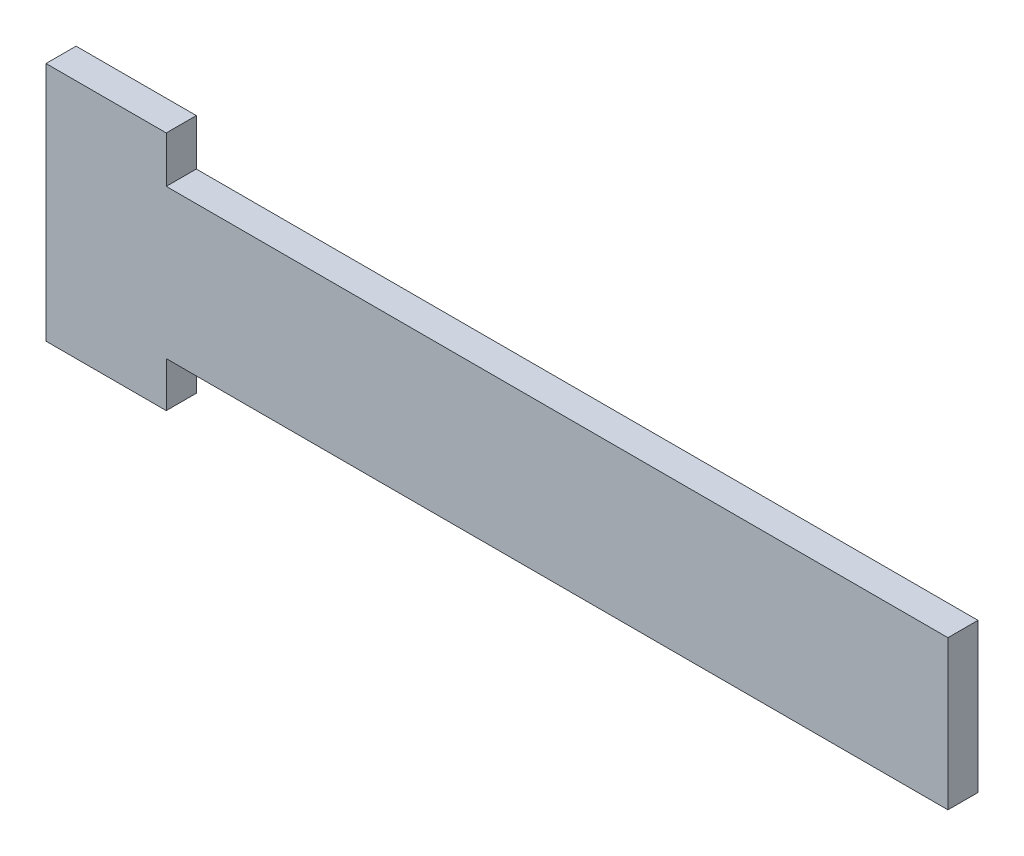
from build123d import *

# Parameters (mm, degrees)
SKETCH_1_W      = 130
SKETCH_1_H      = 24.8
EXTRUDE_1_DEPTH = 5


with BuildPart() as part:
    # 草图1 → 凸台-拉伸1 (new body)
    with BuildSketch(Plane.XY):
        Polygon((-130, -7.5), (-130, 0), (-130, 24.8), (-130, 32.5), (-150, 32.5), (-150, -7.5), align=None)
        with Locations((-65, 12.4)):
            Rectangle(SKETCH_1_W, SKETCH_1_H)
    extrude(amount=EXTRUDE_1_DEPTH)


solid = part.part
